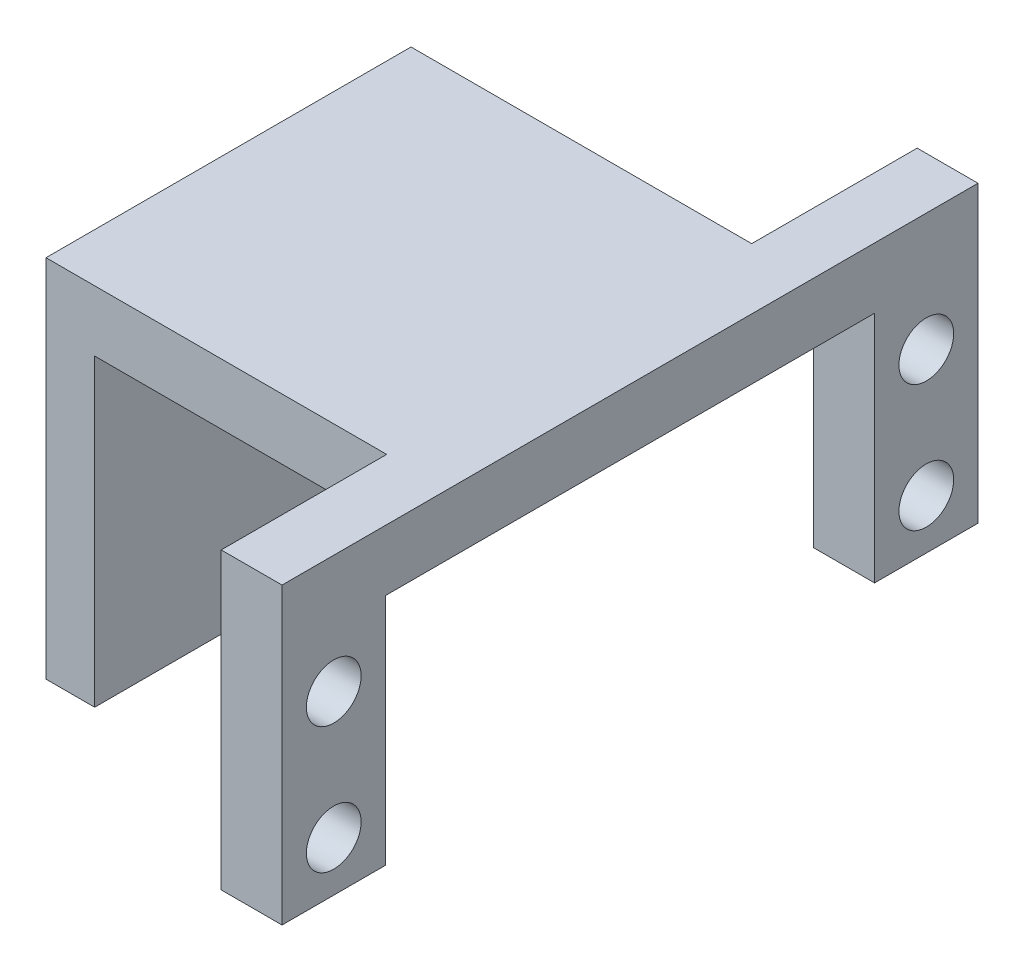
from build123d import *

# Parameters (mm, degrees)
SKETCH1_W            = 30
SKETCH1_H            = 30
BOSS_EXTRUDE1_DEPTH  = 4
SKETCH3_W            = 30
SKETCH3_H            = 5
BOSS_EXTRUDE2_DEPTH  = 24
SKETCH4_W            = 40.2
SKETCH4_H            = 5
BOSS_EXTRUDE3_DEPTH  = 5
SKETCH5_W            = 5
SKETCH5_H            = 24.2
BOSS_EXTRUDE4_DEPTH  = 8.5
LPATTERN1_COUNT      = 2
LPATTERN1_PITCH      = 48.7
M4_CLEARANCE_HOLE1_D = 4.5


with BuildPart() as part:
    # Sketch1 → Boss-Extrude1 (new body)
    with BuildSketch(Plane(origin=(0, 0, 0), x_dir=(0, 0, -1), z_dir=(1, 0, 0))):
        with Locations((15, 15)):
            Rectangle(SKETCH1_W, SKETCH1_H)
    extrude(amount=BOSS_EXTRUDE1_DEPTH)

    # Sketch3 → Boss-Extrude2 (add)
    with BuildSketch(Plane(origin=(4, 0, 0), x_dir=(0, 0, -1), z_dir=(1, 0, 0))):
        with Locations((15, 27.5)):
            Rectangle(SKETCH3_W, SKETCH3_H)
    extrude(amount=BOSS_EXTRUDE2_DEPTH)

    # Sketch4 → Boss-Extrude3 (add)
    with BuildSketch(Plane(origin=(28, 0, 0), x_dir=(0, 0, -1), z_dir=(1, 0, 0))):
        with Locations((15, 27.5)):
            Rectangle(SKETCH4_W, SKETCH4_H)
    extrude(amount=BOSS_EXTRUDE3_DEPTH)

    # Sketch5 → Boss-Extrude4 (add)
    with BuildSketch(Plane.XY.offset(5.1)):
        with Locations((30.5, 17.9)):
            Rectangle(SKETCH5_W, SKETCH5_H)
    boss_extrude4 = extrude(amount=BOSS_EXTRUDE4_DEPTH)

    # LPattern1: Boss-Extrude4 ×2
    with Locations(*[(0, 0, -i * LPATTERN1_PITCH) for i in range(1, LPATTERN1_COUNT)]):
        add(boss_extrude4)

    # M4 Clearance Hole1 (through all)
    with Locations(Plane(origin=(33, 0, 0), x_dir=(0, 0, -1), z_dir=(1, 0, 0))):
        with Locations((-9.35, 20.3), (-9.35, 9.9), (39.35, 20.3), (39.35, 9.9)):
            Hole(M4_CLEARANCE_HOLE1_D / 2)


solid = part.part
